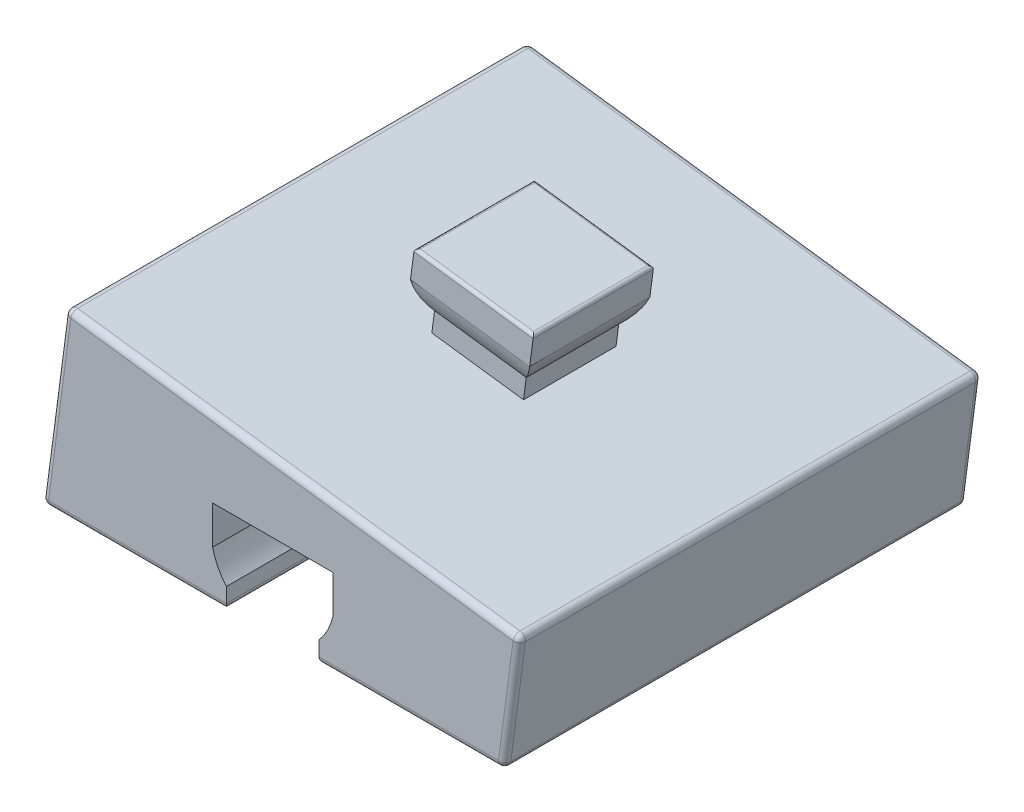
from build123d import *

# Parameters (mm, degrees)
EXTRUDE_1_DEPTH      = 7.5
EXTRUDE_1_DEPTH_BACK = 7.5
EXTRUDE_2_DEPTH      = 1.5
EXTRUDE_2_DEPTH_BACK = 1.5
EXTRUDE_3_DEPTH      = 2
EXTRUDE_3_DEPTH_BACK = 2
CUT_EXTRUDE_1_DEPTH  = 15.42315829
FILLET_1_R           = 0.2
FILLET_2_R           = 0.1


with BuildPart() as part:
    # 草图1 → 凸台-拉伸1 (new, two sides: drawn at the far end of the back side and taken through both)
    with BuildSketch(Plane.XY.offset(-EXTRUDE_1_DEPTH_BACK)):
        with BuildLine():
            Line((-7.5, 0), (-1.5, 0))
            Line((-1.5, 0), (-1.5, 0.677124344))
            ThreePointArc((-1.5, 0.677124344), (-1.780042303, 1.088161527), (-1.95, 1.555590279))
            Line((-1.95, 1.555590279), (-1.95, 2.8))
            Line((-1.95, 2.8), (1.95, 2.8))
            Line((1.95, 2.8), (1.95, 1.555590279))
            ThreePointArc((1.95, 1.555590279), (1.780042303, 1.088161527), (1.5, 0.677124344))
            Line((1.5, 0.677124344), (1.5, 0))
            Line((1.5, 0), (7.5, 0))
            Line((7.5, 0), (8.022104769, 3.965779445))
            Line((8.022104769, 3.965779445), (-6.722338928, 5.906922284))
            Line((-6.722338928, 5.906922284), (-7.5, 0))
        make_face()
    extrude(amount=EXTRUDE_1_DEPTH + EXTRUDE_1_DEPTH_BACK)

    # 草图2 → 凸台-拉伸2 (add, two sides: drawn at the far end of the back side and taken through both)
    with BuildSketch(Plane.XY.offset(-EXTRUDE_2_DEPTH_BACK)):
        Polygon((-0.837284372, 5.132140153), (2.137050212, 4.740561576), (2.267576405, 5.732006438), (-0.70675818, 6.123585014), align=None)
    extrude(amount=EXTRUDE_2_DEPTH + EXTRUDE_2_DEPTH_BACK)

    # 草图3 → 凸台-拉伸3 (add, two sides: drawn at the far end of the back side and taken through both)
    with BuildSketch(Plane.XY.offset(-EXTRUDE_3_DEPTH_BACK)):
        with BuildLine():
            Line((-0.957119079, 7.669489093), (-1.080389284, 6.733158928))
            ThreePointArc((-1.080389284, 6.733158928), (-0.972897293, 6.247545163), (-0.748901909, 5.803471605))
            Line((-0.748901909, 5.803471605), (2.225432675, 5.411893028))
            ThreePointArc((2.225432675, 5.411893028), (2.556730295, 5.782860875), (2.786245676, 6.224106778))
            Line((2.786245676, 6.224106778), (2.909515881, 7.160436943))
            Line((2.909515881, 7.160436943), (-0.957119079, 7.669489093))
        make_face()
    extrude(amount=EXTRUDE_3_DEPTH + EXTRUDE_3_DEPTH_BACK)

    # 草图4 → 切除-拉伸1 (cut, through all)
    with BuildSketch(Plane(origin=(1.93331748, -0.254526075, 0), x_dir=(0, 0, -1), z_dir=(0.9914448613738126, -0.13052619222003545, 0))):
        with BuildLine():
            Line((1.95, 7.478946442), (2, 7.478946442))
            Line((2, 7.478946442), (2, 5.656070786))
            Line((2, 5.656070786), (1.5, 5.656070786))
            ThreePointArc((1.5, 5.656070786), (1.780042303, 6.067107969), (1.95, 6.534536721))
            Line((1.95, 6.534536721), (1.95, 7.478946442))
        make_face()
        with BuildLine():
            Line((-1.95, 7.478946442), (-1.95, 6.534536721))
            ThreePointArc((-1.95, 6.534536721), (-1.780042303, 6.067107969), (-1.5, 5.656070786))
            Line((-1.5, 5.656070786), (-2, 5.656070786))
            Line((-2, 5.656070786), (-2, 7.478946442))
            Line((-2, 7.478946442), (-1.95, 7.478946442))
        make_face()
    extrude(amount=-CUT_EXTRUDE_1_DEPTH, mode=Mode.SUBTRACT)

    # 圆角1
    fillet_1_edges = [part.edges().sort_by_distance(p)[0] for p in [
        (-4.5, 0, -7.5),
        (-7.5, 0, 0),
        (-4.5, 0, 7.5),
        (-1.5, 0, 0),
        (4.5, 0, -7.5),
        (1.5, 0, 0),
        (4.5, 0, 7.5),
        (7.5, 0, 0),
        (0.64988292, 4.936350865, -7.5),
        (-6.722338928, 5.906922284, 0),
        (8.022104769, 3.965779445, 0),
        (0.64988292, 4.936350865, 7.5),
        (-7.111169464, 2.953461142, -7.5),
        (-7.111169464, 2.953461142, 7.5),
        (7.761052384, 1.982889723, -7.5),
        (7.761052384, 1.982889723, 7.5),
    ]]
    fillet(fillet_1_edges, radius=FILLET_1_R)

    # 圆角2
    fillet_2_edges = [part.edges().sort_by_distance(p)[0] for p in [
        (2.909515881, 7.160436943, 0),
        (0.976198401, 7.414963018, 1.95),
        (-0.957119079, 7.669489093, 0),
        (0.976198401, 7.414963018, -1.95),
    ]]
    fillet(fillet_2_edges, radius=FILLET_2_R)


solid = part.part
